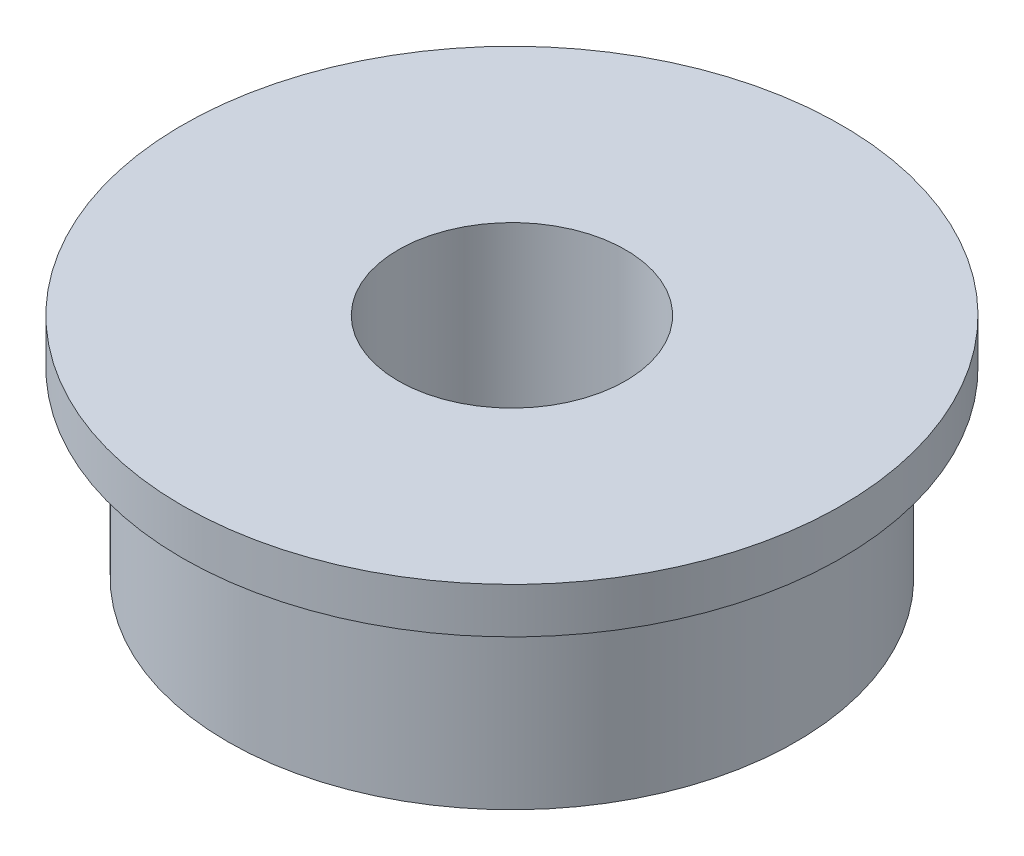
from build123d import *

# Parameters (mm, degrees)
SKETCH_1_R      = 5
SKETCH_1_R_2    = 2
EXTRUDE_1_DEPTH = 4
EXTRUDE_START   = -0.8
SKETCH_2_R      = 5.8
SKETCH_2_R_2    = 5
EXTRUDE_2_DEPTH = 0.8


with BuildPart() as part:
    # 草图1 → 凸台-拉伸1 (new body)
    with BuildSketch(Plane(origin=(0, 0, 0), x_dir=(1, 0, 0), z_dir=(0, 1, 0))):
        with Locations(Location((0, 0, 0), (0, 0, 270))):
            Circle(SKETCH_1_R)
        with Locations(Location((0, 0, 0), (0, 0, 270))):
            Circle(SKETCH_1_R_2, mode=Mode.SUBTRACT)
    extrude(amount=EXTRUDE_1_DEPTH)

    # 草图2 → 凸台-拉伸2 (add)
    with BuildSketch(Plane(origin=(0, 4, 0), x_dir=(1, 0, 0), z_dir=(0, 1, 0)).offset(EXTRUDE_START)):
        with Locations(Location((0, 0, 0), (0, 0, 270))):
            Circle(SKETCH_2_R)
        with Locations(Location((0, 0, 0), (0, 0, 270))):
            Circle(SKETCH_2_R_2, mode=Mode.SUBTRACT)
    extrude(amount=EXTRUDE_2_DEPTH)


solid = part.part
